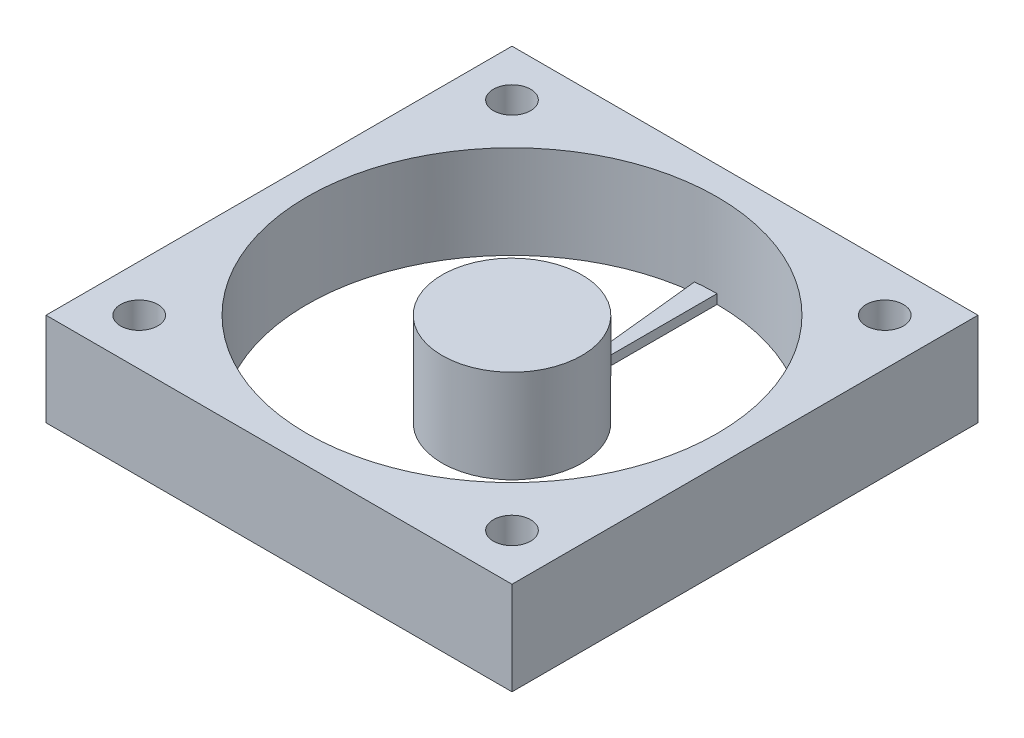
from build123d import *

# Parameters (mm, degrees)
SKETCH_1_W          = 50
SKETCH_1_H          = 50
SKETCH_1_R          = 2
EXTRUDE_1_DEPTH     = 10
SKETCH_2_R          = 22
SKETCH_2_R_2        = 7.5
CUT_EXTRUDE_2_DEPTH = 9
CUT_EXTRUDE_3_DEPTH = 1


with BuildPart() as part:
    # 草图1 → 凸台-拉伸1 (new body)
    with BuildSketch(Plane(origin=(0, 0, 0), x_dir=(1, 0, 0), z_dir=(0, 1, 0))):
        with Locations((25, 25)):
            Rectangle(SKETCH_1_W, SKETCH_1_H)
        with Locations(Location((5, 45, 0), (0, 0, 270))):
            Circle(SKETCH_1_R, mode=Mode.SUBTRACT)
        with Locations(Location((45, 45, 0), (0, 0, 270))):
            Circle(SKETCH_1_R, mode=Mode.SUBTRACT)
        with Locations(Location((45, 5, 0), (0, 0, 270))):
            Circle(SKETCH_1_R, mode=Mode.SUBTRACT)
        with Locations(Location((5, 5, 0), (0, 0, 270))):
            Circle(SKETCH_1_R, mode=Mode.SUBTRACT)
    extrude(amount=EXTRUDE_1_DEPTH)

    # 草图2 → 切除-拉伸2 (cut)
    with BuildSketch(Plane(origin=(0, 10, 0), x_dir=(1, 0, 0), z_dir=(0, 1, 0))):
        with Locations(Location((25, 25, 0), (0, 0, 270))):
            Circle(SKETCH_2_R)
        with Locations(Location((25, 25, 0), (0, 0, 270))):
            Circle(SKETCH_2_R_2, mode=Mode.SUBTRACT)
    extrude(amount=-CUT_EXTRUDE_2_DEPTH, mode=Mode.SUBTRACT)

    # 草图3 → 切除-拉伸3 (cut)
    with BuildSketch(Plane(origin=(0, 1, 0), x_dir=(1, 0, 0), z_dir=(0, 1, 0))):
        with BuildLine():
            Line((24.216036525, 32.458914215), (22.700373808, 46.879481698))
            ThreePointArc((22.700373808, 46.879481698), (26.151391037, 3.030150235), (25, 47))
            Line((25, 47), (25, 32.5))
            ThreePointArc((25, 32.5), (25.392519672, 17.510278489), (24.216036525, 32.458914215))
        make_face()
    extrude(amount=-CUT_EXTRUDE_3_DEPTH, mode=Mode.SUBTRACT)


solid = part.part
